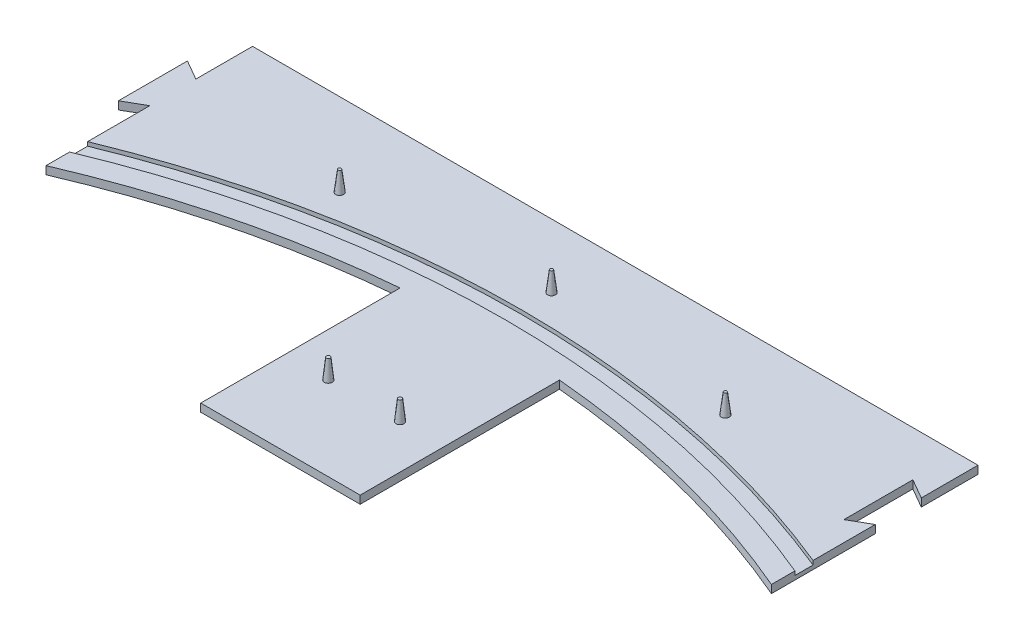
from build123d import *

# Parameters (mm, degrees)
BASEPLATE_PROFILE_DEPTH               = 2
SKETCH2_R                             = 1
M3_PINS_DEPTH                         = 5
M3_PINS_TAPER                         = 7
CIRPATTERN1_COUNT                     = 32
SKETCH4_R                             = 1
PILLAR_PINS_DEPTH                     = 5
PILLAR_PINS_DRAFT                     = 6
PILLAR_PINS_PROFILE_2_DEPTH           = 5
PILLAR_PINS_PROFILE_2_DRAFT           = 6
CIRPATTERN2_COPY_1_SKETCH_R           = 1
CIRPATTERN2_COPY_1_DEPTH              = 5
CIRPATTERN2_COPY_1_DRAFT              = 6
CIRPATTERN2_COPY_2_SKETCH_R           = 1
CIRPATTERN2_COPY_2_DEPTH              = 5
CIRPATTERN2_COPY_2_DRAFT              = 6
CIRPATTERN2_COPY_3_SKETCH_R           = 1
CIRPATTERN2_COPY_3_DEPTH              = 5
CIRPATTERN2_COPY_3_DRAFT              = 6
CIRPATTERN2_COPY_4_SKETCH_R           = 1
CIRPATTERN2_COPY_4_DEPTH              = 5
CIRPATTERN2_COPY_4_DRAFT              = 6
CIRPATTERN2_COPY_5_SKETCH_R           = 1
CIRPATTERN2_COPY_5_DEPTH              = 5
CIRPATTERN2_COPY_5_DRAFT              = 6
CIRPATTERN2_COPY_6_SKETCH_R           = 1
CIRPATTERN2_COPY_6_DEPTH              = 5
CIRPATTERN2_COPY_6_DRAFT              = 6
CIRPATTERN2_COPY_7_SKETCH_R           = 1
CIRPATTERN2_COPY_7_DEPTH              = 5
CIRPATTERN2_COPY_7_DRAFT              = 6
CIRPATTERN2_COPY_8_SKETCH_R           = 1
CIRPATTERN2_COPY_8_DEPTH              = 5
CIRPATTERN2_COPY_8_DRAFT              = 6
CIRPATTERN2_COPY_9_SKETCH_R           = 1
CIRPATTERN2_COPY_9_DEPTH              = 5
CIRPATTERN2_COPY_9_DRAFT              = 6
CIRPATTERN2_COPY_10_SKETCH_R          = 1
CIRPATTERN2_COPY_10_DEPTH             = 5
CIRPATTERN2_COPY_10_DRAFT             = 6
CIRPATTERN2_COPY_11_SKETCH_R          = 1
CIRPATTERN2_COPY_11_DEPTH             = 5
CIRPATTERN2_COPY_11_DRAFT             = 6
CIRPATTERN2_COPY_12_SKETCH_R          = 1
CIRPATTERN2_COPY_12_DEPTH             = 5
CIRPATTERN2_COPY_12_DRAFT             = 6
CIRPATTERN2_COPY_13_SKETCH_R          = 1
CIRPATTERN2_COPY_13_DEPTH             = 5
CIRPATTERN2_COPY_13_DRAFT             = 6
CIRPATTERN2_COPY_14_SKETCH_R          = 1
CIRPATTERN2_COPY_14_DEPTH             = 5
CIRPATTERN2_COPY_14_DRAFT             = 6
CIRPATTERN2_COPY_15_SKETCH_R          = 1
CIRPATTERN2_COPY_15_DEPTH             = 5
CIRPATTERN2_COPY_15_DRAFT             = 6
SKETCH5_R                             = 3
M8_HOLE_1_DEPTH                       = 5
M8_HOLE_1_TAPER                       = 12
M8_1_PATTERN_COUNT                    = 4
SKETCH6_R                             = 3
EXTRUDE_M8_2_DEPTH                    = 5
EXTRUDE_M8_2_TAPER                    = 12
M8_2_PATTERN_COUNT                    = 4
PATTERN_CIRCULAR_M8_3_COUNT           = 2
PATTERN_CIRCULAR_M8_3_ANGLE           = 36.9
PATTERN_CIRCULAR_M8_3_COPY_1_SKETCH_R = 3
PATTERN_CIRCULAR_M8_3_COPY_1_DEPTH    = 5
PATTERN_CIRCULAR_M8_3_COPY_1_TAPER    = 12
PATTERN_CIRCULAR_M8_3_COPY_2_SKETCH_R = 3
PATTERN_CIRCULAR_M8_3_COPY_2_DEPTH    = 5
PATTERN_CIRCULAR_M8_3_COPY_2_TAPER    = 12
PATTERN_CIRCULAR_M8_3_COPY_3_SKETCH_R = 3
PATTERN_CIRCULAR_M8_3_COPY_3_DEPTH    = 5
PATTERN_CIRCULAR_M8_3_COPY_3_TAPER    = 12
CUT_CENTER_DEPTH                      = 374.385859402
CIRPATTERN7_COUNT                     = 6
SKETCH15_W                            = 794.241353176
SKETCH15_H                            = 757.161766401
SKETCH15_W_2                          = 182
SKETCH15_H_2                          = 180
CUT_EXTRUDE3_DEPTH                    = 374.417996354
BOSS_EXTRUDE2_DEPTH                   = 2
CUT_EXTRUDE4_DEPTH                    = 281.95729213
SKETCH18_R                            = 240.5
SKETCH18_R_2                          = 236.3
CUT_EXTRUDE5_DEPTH                    = 1


with BuildPart() as part:
    # Sketch1 → baseplate profile (new body)
    with BuildSketch(Plane(origin=(0, 0, 0), x_dir=(1, 0, 0), z_dir=(0, 1, 0))):
        Polygon((264, 0), (264, 131.98), (131.979594929, 264), (0, 264), (-131.98, 264), (-264, 131.979594929), (-264, 0), (-264, -131.98), (-131.979594929, -264), (0, -264), (131.98, -264), (264, -131.979594929), align=None)
    extrude(amount=-BASEPLATE_PROFILE_DEPTH)

    # Sketch2 → M3 pins (add)
    with BuildSketch(Plane(origin=(0, 0, 0), x_dir=(1, 0, 0), z_dir=(0, 1, 0))):
        with Locations((0, 248)):
            Circle(SKETCH2_R)
    m3_pins = extrude(amount=M3_PINS_DEPTH, taper=M3_PINS_TAPER)

    # CirPattern1: M3 pins ×32 about axis
    cirpattern1_axis = Axis((0, 0, 0), (0, 1, 0))
    for i in range(1, CIRPATTERN1_COUNT):
        add(m3_pins.rotate(cirpattern1_axis, i * 360 / CIRPATTERN1_COUNT))


with BuildPart() as pillar_pins_tool:
    # Sketch4 → pillar pins (with draft: the straight prism first)
    with BuildSketch(Plane(origin=(0, 0, 0), x_dir=(1, 0, 0), z_dir=(0, 1, 0))):
        with Locations((9, 201)):
            Circle(SKETCH4_R)
    extrude(amount=PILLAR_PINS_DEPTH)
    # pillar pins: the draft: its side faces are tilted about the plane it starts from
    pillar_pins_sides = [pillar_pins_tool.faces().sort_by_distance(p)[0] for p in [
        (8, 2.5, -201),
    ]]
    draft(pillar_pins_sides, Plane(origin=(0, 0, 0), x_dir=(1, 0, 0), z_dir=(0, 1, 0)), PILLAR_PINS_DRAFT)


with BuildPart() as part_1:
    add(part.part)

    # pillar pins: add pillar_pins_tool
    add(pillar_pins_tool.part)


with BuildPart() as pillar_pins_profile_2_tool:
    # Sketch4 → pillar pins profile 2 (with draft: the straight prism first)
    with BuildSketch(Plane(origin=(0, 0, 0), x_dir=(1, 0, 0), z_dir=(0, 1, 0))):
        with Locations((-9, 201)):
            Circle(SKETCH4_R)
    extrude(amount=PILLAR_PINS_PROFILE_2_DEPTH)
    # pillar pins profile 2: the draft: its side faces are tilted about the plane it starts from
    pillar_pins_profile_2_sides = [pillar_pins_profile_2_tool.faces().sort_by_distance(p)[0] for p in [
        (-10, 2.5, -201),
    ]]
    draft(pillar_pins_profile_2_sides, Plane(origin=(0, 0, 0), x_dir=(1, 0, 0), z_dir=(0, 1, 0)), PILLAR_PINS_PROFILE_2_DRAFT)


with BuildPart() as part_2:
    add(part_1.part)

    # pillar pins profile 2: add pillar_pins_profile_2_tool
    add(pillar_pins_profile_2_tool.part)


with BuildPart() as cirpattern2_copy_1_tool:
    # CirPattern2 copy 1 sketch → CirPattern2 copy 1 (with draft: the straight prism first)
    with BuildSketch(Plane(origin=(0, 0, 0), x_dir=(0.5000000000000001, 0, -0.8660254037844386), z_dir=(0, 1, 0))):
        with Locations((9, 201)):
            Circle(CIRPATTERN2_COPY_1_SKETCH_R)
    extrude(amount=CIRPATTERN2_COPY_1_DEPTH)
    # CirPattern2 copy 1: the draft: its side faces are tilted about the plane it starts from
    cirpattern2_copy_1_sides = [cirpattern2_copy_1_tool.faces().sort_by_distance(p)[0] for p in [
        (-170.071106161, 2.5, -107.42820323),
    ]]
    draft(cirpattern2_copy_1_sides, Plane(origin=(0, 0, 0), x_dir=(0.5000000000000001, 0, -0.8660254037844386), z_dir=(0, 1, 0)), CIRPATTERN2_COPY_1_DRAFT)


with BuildPart() as part_3:
    add(part_2.part)

    # CirPattern2 copy 1: add cirpattern2_copy_1_tool
    add(cirpattern2_copy_1_tool.part)


with BuildPart() as cirpattern2_copy_2_tool:
    # CirPattern2 copy 2 sketch → CirPattern2 copy 2 (with draft: the straight prism first)
    with BuildSketch(Plane(origin=(0, 0, 0), x_dir=(-0.4999999999999998, 0, -0.8660254037844387), z_dir=(0, 1, 0))):
        with Locations((9, 201)):
            Circle(CIRPATTERN2_COPY_2_SKETCH_R)
    extrude(amount=CIRPATTERN2_COPY_2_DEPTH)
    # CirPattern2 copy 2: the draft: its side faces are tilted about the plane it starts from
    cirpattern2_copy_2_sides = [cirpattern2_copy_2_tool.faces().sort_by_distance(p)[0] for p in [
        (-178.071106161, 2.5, 93.57179677),
    ]]
    draft(cirpattern2_copy_2_sides, Plane(origin=(0, 0, 0), x_dir=(-0.4999999999999998, 0, -0.8660254037844387), z_dir=(0, 1, 0)), CIRPATTERN2_COPY_2_DRAFT)


with BuildPart() as part_4:
    add(part_3.part)

    # CirPattern2 copy 2: add cirpattern2_copy_2_tool
    add(cirpattern2_copy_2_tool.part)


with BuildPart() as cirpattern2_copy_3_tool:
    # CirPattern2 copy 3 sketch → CirPattern2 copy 3 (with draft: the straight prism first)
    with BuildSketch(Plane(origin=(0, 0, 0), x_dir=(-1, 0, 0), z_dir=(0, 1, 0))):
        with Locations((9, 201)):
            Circle(CIRPATTERN2_COPY_3_SKETCH_R)
    extrude(amount=CIRPATTERN2_COPY_3_DEPTH)
    # CirPattern2 copy 3: the draft: its side faces are tilted about the plane it starts from
    cirpattern2_copy_3_sides = [cirpattern2_copy_3_tool.faces().sort_by_distance(p)[0] for p in [
        (-8, 2.5, 201),
    ]]
    draft(cirpattern2_copy_3_sides, Plane(origin=(0, 0, 0), x_dir=(-1, 0, 0), z_dir=(0, 1, 0)), CIRPATTERN2_COPY_3_DRAFT)


with BuildPart() as part_5:
    add(part_4.part)

    # CirPattern2 copy 3: add cirpattern2_copy_3_tool
    add(cirpattern2_copy_3_tool.part)


with BuildPart() as cirpattern2_copy_4_tool:
    # CirPattern2 copy 4 sketch → CirPattern2 copy 4 (with draft: the straight prism first)
    with BuildSketch(Plane(origin=(0, 0, 0), x_dir=(-0.5000000000000004, 0, 0.8660254037844384), z_dir=(0, 1, 0))):
        with Locations((9, 201)):
            Circle(CIRPATTERN2_COPY_4_SKETCH_R)
    extrude(amount=CIRPATTERN2_COPY_4_DEPTH)
    # CirPattern2 copy 4: the draft: its side faces are tilted about the plane it starts from
    cirpattern2_copy_4_sides = [cirpattern2_copy_4_tool.faces().sort_by_distance(p)[0] for p in [
        (170.071106161, 2.5, 107.42820323),
    ]]
    draft(cirpattern2_copy_4_sides, Plane(origin=(0, 0, 0), x_dir=(-0.5000000000000004, 0, 0.8660254037844384), z_dir=(0, 1, 0)), CIRPATTERN2_COPY_4_DRAFT)


with BuildPart() as part_6:
    add(part_5.part)

    # CirPattern2 copy 4: add cirpattern2_copy_4_tool
    add(cirpattern2_copy_4_tool.part)


with BuildPart() as cirpattern2_copy_5_tool:
    # CirPattern2 copy 5 sketch → CirPattern2 copy 5 (with draft: the straight prism first)
    with BuildSketch(Plane(origin=(0, 0, 0), x_dir=(0.5000000000000001, 0, 0.8660254037844386), z_dir=(0, 1, 0))):
        with Locations((9, 201)):
            Circle(CIRPATTERN2_COPY_5_SKETCH_R)
    extrude(amount=CIRPATTERN2_COPY_5_DEPTH)
    # CirPattern2 copy 5: the draft: its side faces are tilted about the plane it starts from
    cirpattern2_copy_5_sides = [cirpattern2_copy_5_tool.faces().sort_by_distance(p)[0] for p in [
        (178.071106161, 2.5, -93.57179677),
    ]]
    draft(cirpattern2_copy_5_sides, Plane(origin=(0, 0, 0), x_dir=(0.5000000000000001, 0, 0.8660254037844386), z_dir=(0, 1, 0)), CIRPATTERN2_COPY_5_DRAFT)


with BuildPart() as part_7:
    add(part_6.part)

    # CirPattern2 copy 5: add cirpattern2_copy_5_tool
    add(cirpattern2_copy_5_tool.part)


with BuildPart() as cirpattern2_copy_6_tool:
    # CirPattern2 copy 6 sketch → CirPattern2 copy 6 (with draft: the straight prism first)
    with BuildSketch(Plane(origin=(0, 0, 0), x_dir=(0.5000000000000001, 0, -0.8660254037844386), z_dir=(0, 1, 0))):
        with Locations((-9, 201)):
            Circle(CIRPATTERN2_COPY_6_SKETCH_R)
    extrude(amount=CIRPATTERN2_COPY_6_DEPTH)
    # CirPattern2 copy 6: the draft: its side faces are tilted about the plane it starts from
    cirpattern2_copy_6_sides = [cirpattern2_copy_6_tool.faces().sort_by_distance(p)[0] for p in [
        (-179.071106161, 2.5, -91.839745962),
    ]]
    draft(cirpattern2_copy_6_sides, Plane(origin=(0, 0, 0), x_dir=(0.5000000000000001, 0, -0.8660254037844386), z_dir=(0, 1, 0)), CIRPATTERN2_COPY_6_DRAFT)


with BuildPart() as part_8:
    add(part_7.part)

    # CirPattern2 copy 6: add cirpattern2_copy_6_tool
    add(cirpattern2_copy_6_tool.part)


with BuildPart() as cirpattern2_copy_7_tool:
    # CirPattern2 copy 7 sketch → CirPattern2 copy 7 (with draft: the straight prism first)
    with BuildSketch(Plane(origin=(0, 0, 0), x_dir=(-0.4999999999999998, 0, -0.8660254037844387), z_dir=(0, 1, 0))):
        with Locations((-9, 201)):
            Circle(CIRPATTERN2_COPY_7_SKETCH_R)
    extrude(amount=CIRPATTERN2_COPY_7_DEPTH)
    # CirPattern2 copy 7: the draft: its side faces are tilted about the plane it starts from
    cirpattern2_copy_7_sides = [cirpattern2_copy_7_tool.faces().sort_by_distance(p)[0] for p in [
        (-169.071106161, 2.5, 109.160254038),
    ]]
    draft(cirpattern2_copy_7_sides, Plane(origin=(0, 0, 0), x_dir=(-0.4999999999999998, 0, -0.8660254037844387), z_dir=(0, 1, 0)), CIRPATTERN2_COPY_7_DRAFT)


with BuildPart() as part_9:
    add(part_8.part)

    # CirPattern2 copy 7: add cirpattern2_copy_7_tool
    add(cirpattern2_copy_7_tool.part)


with BuildPart() as cirpattern2_copy_8_tool:
    # CirPattern2 copy 8 sketch → CirPattern2 copy 8 (with draft: the straight prism first)
    with BuildSketch(Plane(origin=(0, 0, 0), x_dir=(-1, 0, 0), z_dir=(0, 1, 0))):
        with Locations((-9, 201)):
            Circle(CIRPATTERN2_COPY_8_SKETCH_R)
    extrude(amount=CIRPATTERN2_COPY_8_DEPTH)
    # CirPattern2 copy 8: the draft: its side faces are tilted about the plane it starts from
    cirpattern2_copy_8_sides = [cirpattern2_copy_8_tool.faces().sort_by_distance(p)[0] for p in [
        (10, 2.5, 201),
    ]]
    draft(cirpattern2_copy_8_sides, Plane(origin=(0, 0, 0), x_dir=(-1, 0, 0), z_dir=(0, 1, 0)), CIRPATTERN2_COPY_8_DRAFT)


with BuildPart() as part_10:
    add(part_9.part)

    # CirPattern2 copy 8: add cirpattern2_copy_8_tool
    add(cirpattern2_copy_8_tool.part)


with BuildPart() as cirpattern2_copy_9_tool:
    # CirPattern2 copy 9 sketch → CirPattern2 copy 9 (with draft: the straight prism first)
    with BuildSketch(Plane(origin=(0, 0, 0), x_dir=(-0.5000000000000004, 0, 0.8660254037844384), z_dir=(0, 1, 0))):
        with Locations((-9, 201)):
            Circle(CIRPATTERN2_COPY_9_SKETCH_R)
    extrude(amount=CIRPATTERN2_COPY_9_DEPTH)
    # CirPattern2 copy 9: the draft: its side faces are tilted about the plane it starts from
    cirpattern2_copy_9_sides = [cirpattern2_copy_9_tool.faces().sort_by_distance(p)[0] for p in [
        (179.071106161, 2.5, 91.839745962),
    ]]
    draft(cirpattern2_copy_9_sides, Plane(origin=(0, 0, 0), x_dir=(-0.5000000000000004, 0, 0.8660254037844384), z_dir=(0, 1, 0)), CIRPATTERN2_COPY_9_DRAFT)


with BuildPart() as part_11:
    add(part_10.part)

    # CirPattern2 copy 9: add cirpattern2_copy_9_tool
    add(cirpattern2_copy_9_tool.part)


with BuildPart() as cirpattern2_copy_10_tool:
    # CirPattern2 copy 10 sketch → CirPattern2 copy 10 (with draft: the straight prism first)
    with BuildSketch(Plane(origin=(0, 0, 0), x_dir=(0.5000000000000001, 0, 0.8660254037844386), z_dir=(0, 1, 0))):
        with Locations((-9, 201)):
            Circle(CIRPATTERN2_COPY_10_SKETCH_R)
    extrude(amount=CIRPATTERN2_COPY_10_DEPTH)
    # CirPattern2 copy 10: the draft: its side faces are tilted about the plane it starts from
    cirpattern2_copy_10_sides = [cirpattern2_copy_10_tool.faces().sort_by_distance(p)[0] for p in [
        (169.071106161, 2.5, -109.160254038),
    ]]
    draft(cirpattern2_copy_10_sides, Plane(origin=(0, 0, 0), x_dir=(0.5000000000000001, 0, 0.8660254037844386), z_dir=(0, 1, 0)), CIRPATTERN2_COPY_10_DRAFT)


with BuildPart() as part_12:
    add(part_11.part)

    # CirPattern2 copy 10: add cirpattern2_copy_10_tool
    add(cirpattern2_copy_10_tool.part)


with BuildPart() as cirpattern2_copy_11_tool:
    # CirPattern2 copy 11 sketch → CirPattern2 copy 11 (with draft: the straight prism first)
    with BuildSketch(Plane(origin=(0, 0, 0), x_dir=(0.5000000000000001, 0, -0.8660254037844386), z_dir=(0, 1, 0))):
        with Locations((-9, 201)):
            Circle(CIRPATTERN2_COPY_11_SKETCH_R)
    extrude(amount=CIRPATTERN2_COPY_11_DEPTH)
    # CirPattern2 copy 11: the draft: its side faces are tilted about the plane it starts from
    cirpattern2_copy_11_sides = [cirpattern2_copy_11_tool.faces().sort_by_distance(p)[0] for p in [
        (-179.071106161, 2.5, -91.839745962),
    ]]
    draft(cirpattern2_copy_11_sides, Plane(origin=(0, 0, 0), x_dir=(0.5000000000000001, 0, -0.8660254037844386), z_dir=(0, 1, 0)), CIRPATTERN2_COPY_11_DRAFT)


with BuildPart() as part_13:
    add(part_12.part)

    # CirPattern2 copy 11: add cirpattern2_copy_11_tool
    add(cirpattern2_copy_11_tool.part)


with BuildPart() as cirpattern2_copy_12_tool:
    # CirPattern2 copy 12 sketch → CirPattern2 copy 12 (with draft: the straight prism first)
    with BuildSketch(Plane(origin=(0, 0, 0), x_dir=(-0.4999999999999998, 0, -0.8660254037844387), z_dir=(0, 1, 0))):
        with Locations((-9, 201)):
            Circle(CIRPATTERN2_COPY_12_SKETCH_R)
    extrude(amount=CIRPATTERN2_COPY_12_DEPTH)
    # CirPattern2 copy 12: the draft: its side faces are tilted about the plane it starts from
    cirpattern2_copy_12_sides = [cirpattern2_copy_12_tool.faces().sort_by_distance(p)[0] for p in [
        (-169.071106161, 2.5, 109.160254038),
    ]]
    draft(cirpattern2_copy_12_sides, Plane(origin=(0, 0, 0), x_dir=(-0.4999999999999998, 0, -0.8660254037844387), z_dir=(0, 1, 0)), CIRPATTERN2_COPY_12_DRAFT)


with BuildPart() as part_14:
    add(part_13.part)

    # CirPattern2 copy 12: add cirpattern2_copy_12_tool
    add(cirpattern2_copy_12_tool.part)


with BuildPart() as cirpattern2_copy_13_tool:
    # CirPattern2 copy 13 sketch → CirPattern2 copy 13 (with draft: the straight prism first)
    with BuildSketch(Plane(origin=(0, 0, 0), x_dir=(-1, 0, 0), z_dir=(0, 1, 0))):
        with Locations((-9, 201)):
            Circle(CIRPATTERN2_COPY_13_SKETCH_R)
    extrude(amount=CIRPATTERN2_COPY_13_DEPTH)
    # CirPattern2 copy 13: the draft: its side faces are tilted about the plane it starts from
    cirpattern2_copy_13_sides = [cirpattern2_copy_13_tool.faces().sort_by_distance(p)[0] for p in [
        (10, 2.5, 201),
    ]]
    draft(cirpattern2_copy_13_sides, Plane(origin=(0, 0, 0), x_dir=(-1, 0, 0), z_dir=(0, 1, 0)), CIRPATTERN2_COPY_13_DRAFT)


with BuildPart() as part_15:
    add(part_14.part)

    # CirPattern2 copy 13: add cirpattern2_copy_13_tool
    add(cirpattern2_copy_13_tool.part)


with BuildPart() as cirpattern2_copy_14_tool:
    # CirPattern2 copy 14 sketch → CirPattern2 copy 14 (with draft: the straight prism first)
    with BuildSketch(Plane(origin=(0, 0, 0), x_dir=(-0.5000000000000004, 0, 0.8660254037844384), z_dir=(0, 1, 0))):
        with Locations((-9, 201)):
            Circle(CIRPATTERN2_COPY_14_SKETCH_R)
    extrude(amount=CIRPATTERN2_COPY_14_DEPTH)
    # CirPattern2 copy 14: the draft: its side faces are tilted about the plane it starts from
    cirpattern2_copy_14_sides = [cirpattern2_copy_14_tool.faces().sort_by_distance(p)[0] for p in [
        (179.071106161, 2.5, 91.839745962),
    ]]
    draft(cirpattern2_copy_14_sides, Plane(origin=(0, 0, 0), x_dir=(-0.5000000000000004, 0, 0.8660254037844384), z_dir=(0, 1, 0)), CIRPATTERN2_COPY_14_DRAFT)


with BuildPart() as part_16:
    add(part_15.part)

    # CirPattern2 copy 14: add cirpattern2_copy_14_tool
    add(cirpattern2_copy_14_tool.part)


with BuildPart() as cirpattern2_copy_15_tool:
    # CirPattern2 copy 15 sketch → CirPattern2 copy 15 (with draft: the straight prism first)
    with BuildSketch(Plane(origin=(0, 0, 0), x_dir=(0.5000000000000001, 0, 0.8660254037844386), z_dir=(0, 1, 0))):
        with Locations((-9, 201)):
            Circle(CIRPATTERN2_COPY_15_SKETCH_R)
    extrude(amount=CIRPATTERN2_COPY_15_DEPTH)
    # CirPattern2 copy 15: the draft: its side faces are tilted about the plane it starts from
    cirpattern2_copy_15_sides = [cirpattern2_copy_15_tool.faces().sort_by_distance(p)[0] for p in [
        (169.071106161, 2.5, -109.160254038),
    ]]
    draft(cirpattern2_copy_15_sides, Plane(origin=(0, 0, 0), x_dir=(0.5000000000000001, 0, 0.8660254037844386), z_dir=(0, 1, 0)), CIRPATTERN2_COPY_15_DRAFT)


with BuildPart() as part_17:
    add(part_16.part)

    # CirPattern2 copy 15: add cirpattern2_copy_15_tool
    add(cirpattern2_copy_15_tool.part)

    # Sketch5 → M8 hole -1 (add)
    with BuildSketch(Plane(origin=(0, 0, 0), x_dir=(1, 0, 0), z_dir=(0, 1, 0))):
        with Locations((-193.040151264, 193.040151264)):
            Circle(SKETCH5_R)
    m8_hole_1 = extrude(amount=M8_HOLE_1_DEPTH, taper=M8_HOLE_1_TAPER)

    # M8 -1 pattern: M8 hole -1 ×4 about axis
    m8_1_pattern_axis = Axis((0, 0, 0), (0, 1, 0))
    for i in range(1, M8_1_PATTERN_COUNT):
        add(m8_hole_1.rotate(m8_1_pattern_axis, i * 360 / M8_1_PATTERN_COUNT))

    # Sketch6 → M8 -2 (add)
    with BuildSketch(Plane(origin=(0, 0, 0), x_dir=(1, 0, 0), z_dir=(0, 1, 0))):
        with Locations((-125, -250)):
            Circle(SKETCH6_R)
    extrude_m8_2 = extrude(amount=EXTRUDE_M8_2_DEPTH, taper=EXTRUDE_M8_2_TAPER)

    # M8 -2 pattern: M8 -2 ×4 about axis
    m8_2_pattern_axis = Axis((0, 0, 0), (0, 1, 0))
    for i in range(1, M8_2_PATTERN_COUNT):
        add(extrude_m8_2.rotate(m8_2_pattern_axis, i * 360 / M8_2_PATTERN_COUNT))

    # M8 -3: M8 -2 ×2 about axis
    pattern_circular_m8_3_axis = Axis((0, 0, 0), (0, -1, 0))
    for i in range(1, PATTERN_CIRCULAR_M8_3_COUNT):
        add(extrude_m8_2.rotate(pattern_circular_m8_3_axis, i * PATTERN_CIRCULAR_M8_3_ANGLE / (PATTERN_CIRCULAR_M8_3_COUNT - 1)))

    # M8 -3 copy 1 sketch → M8 -3 copy 1 (add)
    with BuildSketch(Plane(origin=(0, 0, 0), x_dir=(0.6004202253258852, 0, -0.7996846584870897), z_dir=(0, 1, 0))):
        with Locations((-125, -250)):
            Circle(PATTERN_CIRCULAR_M8_3_COPY_1_SKETCH_R)
    extrude(amount=PATTERN_CIRCULAR_M8_3_COPY_1_DEPTH, taper=PATTERN_CIRCULAR_M8_3_COPY_1_TAPER)

    # M8 -3 copy 2 sketch → M8 -3 copy 2 (add)
    with BuildSketch(Plane(origin=(0, 0, 0), x_dir=(-0.7996846584870896, 0, -0.6004202253258853), z_dir=(0, 1, 0))):
        with Locations((-125, -250)):
            Circle(PATTERN_CIRCULAR_M8_3_COPY_2_SKETCH_R)
    extrude(amount=PATTERN_CIRCULAR_M8_3_COPY_2_DEPTH, taper=PATTERN_CIRCULAR_M8_3_COPY_2_TAPER)

    # M8 -3 copy 3 sketch → M8 -3 copy 3 (add)
    with BuildSketch(Plane(origin=(0, 0, 0), x_dir=(-0.6004202253258853, 0, 0.7996846584870896), z_dir=(0, 1, 0))):
        with Locations((-125, -250)):
            Circle(PATTERN_CIRCULAR_M8_3_COPY_3_SKETCH_R)
    extrude(amount=PATTERN_CIRCULAR_M8_3_COPY_3_DEPTH, taper=PATTERN_CIRCULAR_M8_3_COPY_3_TAPER)

    # Sketch8 → cut center (cut, through all)
    with BuildSketch(Plane(origin=(0, 0, 0), x_dir=(1, 0, 0), z_dir=(0, 1, 0))):
        with BuildLine():
            Line((115.433963806, -199.937490231), (0, 0))
            Line((0, 0), (0, -180))
            Line((0, -180), (20, -180))
            Line((20, -180), (20, -230))
            ThreePointArc((20, -230), (69.365180469, -220.200980331), (115.433963806, -199.937490231))
        make_face()
        with BuildLine():
            Line((0, -180), (0, 0))
            Line((0, 0), (-115.433963806, -199.937490231))
            ThreePointArc((-115.433963806, -199.937490231), (-69.365180469, -220.200980331), (-20, -230))
            Line((-20, -230), (-20, -180))
            Line((-20, -180), (0, -180))
        make_face()
    cut_center = extrude(amount=-CUT_CENTER_DEPTH, mode=Mode.SUBTRACT)

    # CirPattern7: cut center ×6 about axis
    cirpattern7_axis = Axis((0, 0, 0), (0, 1, 0))
    for i in range(1, CIRPATTERN7_COUNT):
        add(cut_center.rotate(cirpattern7_axis, i * 360 / CIRPATTERN7_COUNT), mode=Mode.SUBTRACT)

    # Sketch15 → Cut-Extrude3 (cut, through all)
    with BuildSketch(Plane(origin=(0, -2, 0), x_dir=(-1, 0, 0), z_dir=(0, -1, 0))):
        with Locations((45.380035271, -59.166137501)):
            Rectangle(SKETCH15_W, SKETCH15_H)
        with Locations((0, 200)):
            Rectangle(SKETCH15_W_2, SKETCH15_H_2, mode=Mode.SUBTRACT)
    extrude(amount=-CUT_EXTRUDE3_DEPTH, mode=Mode.SUBTRACT)

    # Sketch16 → Boss-Extrude2 (add)
    with BuildSketch(Plane(origin=(0, 0, 0), x_dir=(1, 0, 0), z_dir=(0, 1, 0))):
        Polygon((-96, 252.660254038), (-96, 235.339745962), (-81, 244), align=None)
    extrude(amount=-BOSS_EXTRUDE2_DEPTH)

    # Sketch17 → Cut-Extrude4 (cut, through all)
    with BuildSketch(Plane(origin=(0, 0, 0), x_dir=(1, 0, 0), z_dir=(0, 1, 0))):
        Polygon((101, 244), (86, 252.660254038), (86, 235.339745962), align=None)
    extrude(amount=-CUT_EXTRUDE4_DEPTH, mode=Mode.SUBTRACT)

    # Sketch18 → Cut-Extrude5 (cut)
    with BuildSketch(Plane(origin=(0, 0, 0), x_dir=(1, 0, 0), z_dir=(0, 1, 0))):
        Circle(SKETCH18_R)
        Circle(SKETCH18_R_2, mode=Mode.SUBTRACT)
    extrude(amount=-CUT_EXTRUDE5_DEPTH, mode=Mode.SUBTRACT)


solid = part_17.part
